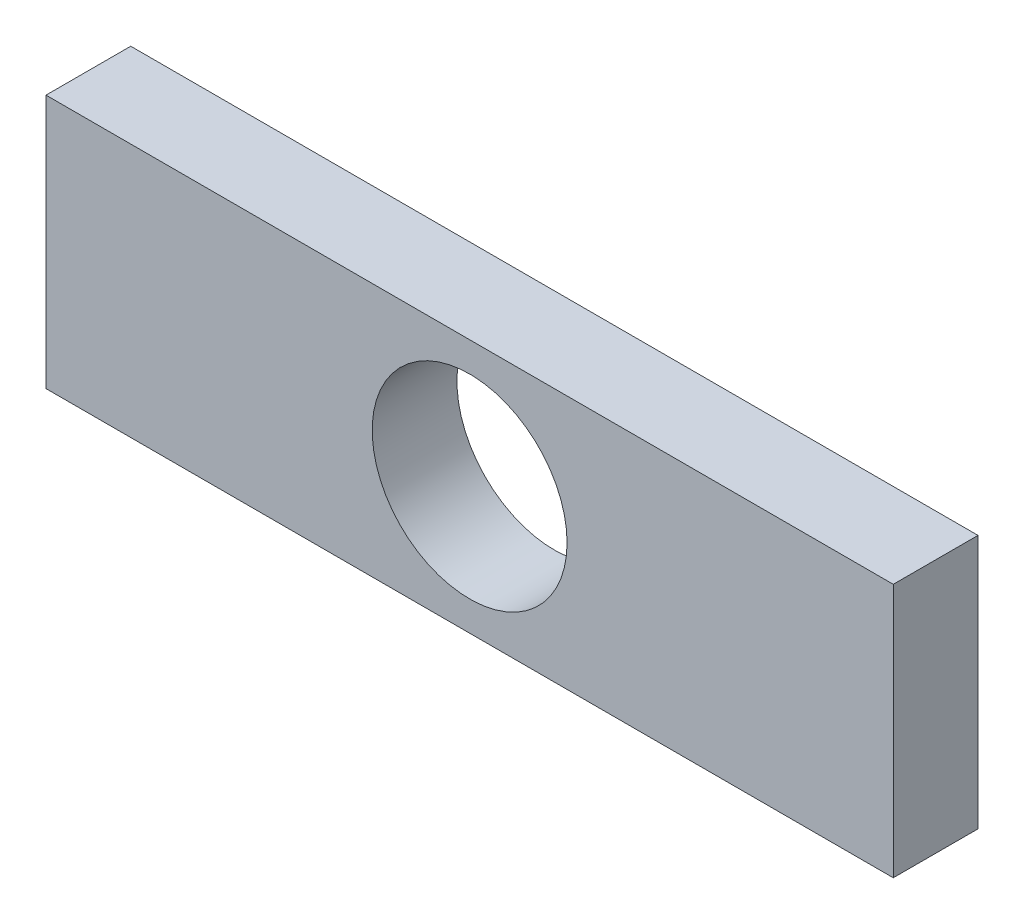
from build123d import *

# Parameters (mm, degrees)
SKETCH4_W           = 20
SKETCH4_H           = 6
SKETCH4_R           = 2.3
BOSS_EXTRUDE2_DEPTH = 2


with BuildPart() as part:
    # Sketch4 → Boss-Extrude2 (new body)
    with BuildSketch(Plane.XY):
        with Locations((10, -3)):
            Rectangle(SKETCH4_W, SKETCH4_H)
        with Locations((10, -3)):
            Circle(SKETCH4_R, mode=Mode.SUBTRACT)
    extrude(amount=BOSS_EXTRUDE2_DEPTH)


solid = part.part
